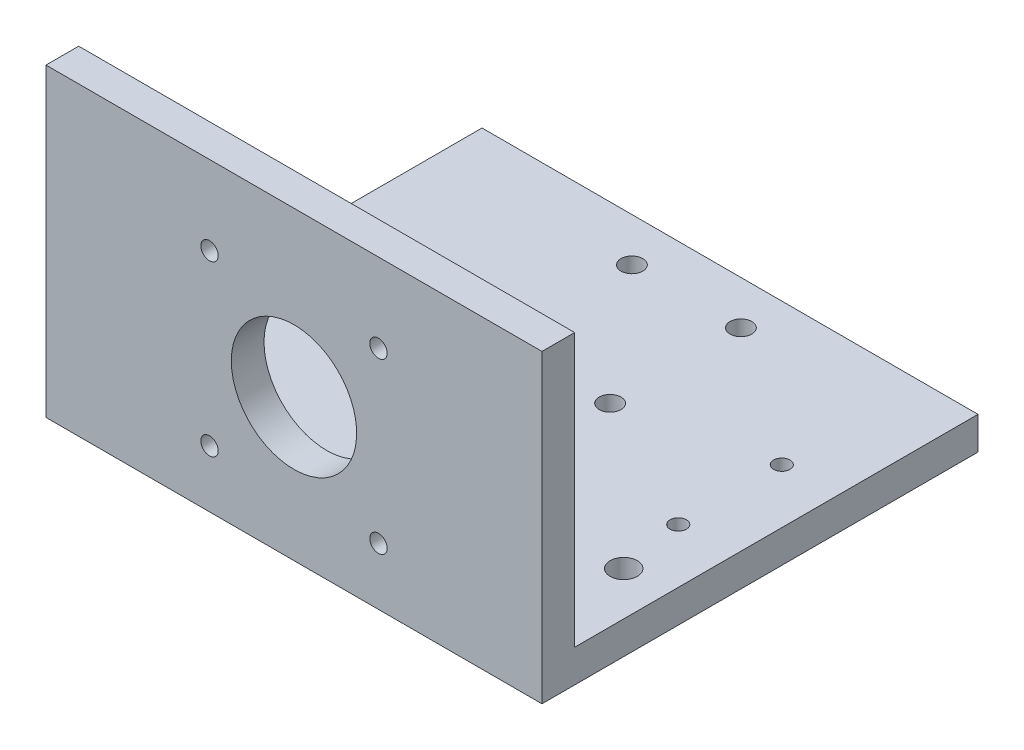
from build123d import *

# Parameters (mm, degrees)
EXTRUDE_1_DEPTH     = 104
SKETCH_2_R          = 2
SKETCH_2_R_2        = 2.5
SKETCH_2_R_3        = 1.5
SKETCH_2_W          = 6.5
SKETCH_2_H          = 74
CUT_EXTRUDE_1_DEPTH = 151.638640461
SKETCH_3_R          = 11.5
SKETCH_3_R_2        = 1.6
CUT_EXTRUDE_2_DEPTH = 151.638640461


with BuildPart() as part:
    # 草图1 → 凸台-拉伸1 (new body)
    with BuildSketch(Plane(origin=(0, 0, 0), x_dir=(0, 0, -1), z_dir=(1, 0, 0))):
        Polygon((0, 0), (80, 0), (80, 6), (6, 6), (6, 80), (0, 80), (0, 6), align=None)
    extrude(amount=EXTRUDE_1_DEPTH)

    # 草图2 → 切除-拉伸1 (cut, through all)
    with BuildSketch(Plane(origin=(0, 6, 0), x_dir=(1, 0, 0), z_dir=(0, 1, 0))):
        with Locations(Location((43, 11, 0), (0, 0, 270))):
            Circle(SKETCH_2_R)
        with Locations(Location((43, 35, 0), (0, 0, 270))):
            Circle(SKETCH_2_R)
        with Locations(Location((42, 48, 0), (0, 0, 270))):
            Circle(SKETCH_2_R)
        with Locations(Location((42, 72, 0), (0, 0, 270))):
            Circle(SKETCH_2_R)
        with Locations(Location((62, 72, 0), (0, 0, 90))):
            Circle(SKETCH_2_R)
        with Locations(Location((62, 48, 0), (0, 0, 90))):
            Circle(SKETCH_2_R)
        with Locations(Location((61, 35, 0), (0, 0, 90))):
            Circle(SKETCH_2_R)
        with Locations(Location((61, 11, 0), (0, 0, 90))):
            Circle(SKETCH_2_R)
        with Locations(Location((57.5, 23, 0), (0, 0, 270))):
            Circle(SKETCH_2_R_2)
        with Locations(Location((89.5, 23, 0), (0, 0, 270))):
            Circle(SKETCH_2_R_2)
        with Locations(Location((46.5, 23, 0), (0, 0, 90))):
            Circle(SKETCH_2_R_2)
        with Locations(Location((14.5, 23, 0), (0, 0, 90))):
            Circle(SKETCH_2_R_2)
        with Locations(Location((87.5, 35, 0), (0, 0, 90))):
            Circle(SKETCH_2_R_3)
        with Locations(Location((87.5, 54, 0), (0, 0, 90))):
            Circle(SKETCH_2_R_3)
        with Locations((100.75, 43)):
            Rectangle(SKETCH_2_W, SKETCH_2_H)
        with Locations((3.25, 43)):
            Rectangle(SKETCH_2_W, SKETCH_2_H)
    extrude(amount=-CUT_EXTRUDE_1_DEPTH, mode=Mode.SUBTRACT)

    # 草图3 → 切除-拉伸2 (cut, through all)
    with BuildSketch(Plane(origin=(0, 0, -6), x_dir=(-1, 0, 0), z_dir=(0, 0, -1))):
        with Locations((-52, 26)):
            Circle(SKETCH_3_R)
        with Locations((-36.5, 41.5)):
            Circle(SKETCH_3_R_2)
        with Locations(Location((-67.5, 41.5, 0), (0, 0, 180))):
            Circle(SKETCH_3_R_2)
        with Locations((-67.5, 10.5)):
            Circle(SKETCH_3_R_2)
        with Locations(Location((-36.5, 10.5, 0), (0, 0, 180))):
            Circle(SKETCH_3_R_2)
        Polygon((-97.5, 0), (-97.5, 56), (-6.5, 56), (-6.5, 0), (0, 0), (0, 80), (-104, 80), (-104, 0), align=None)
    extrude(amount=-CUT_EXTRUDE_2_DEPTH, mode=Mode.SUBTRACT)


solid = part.part
